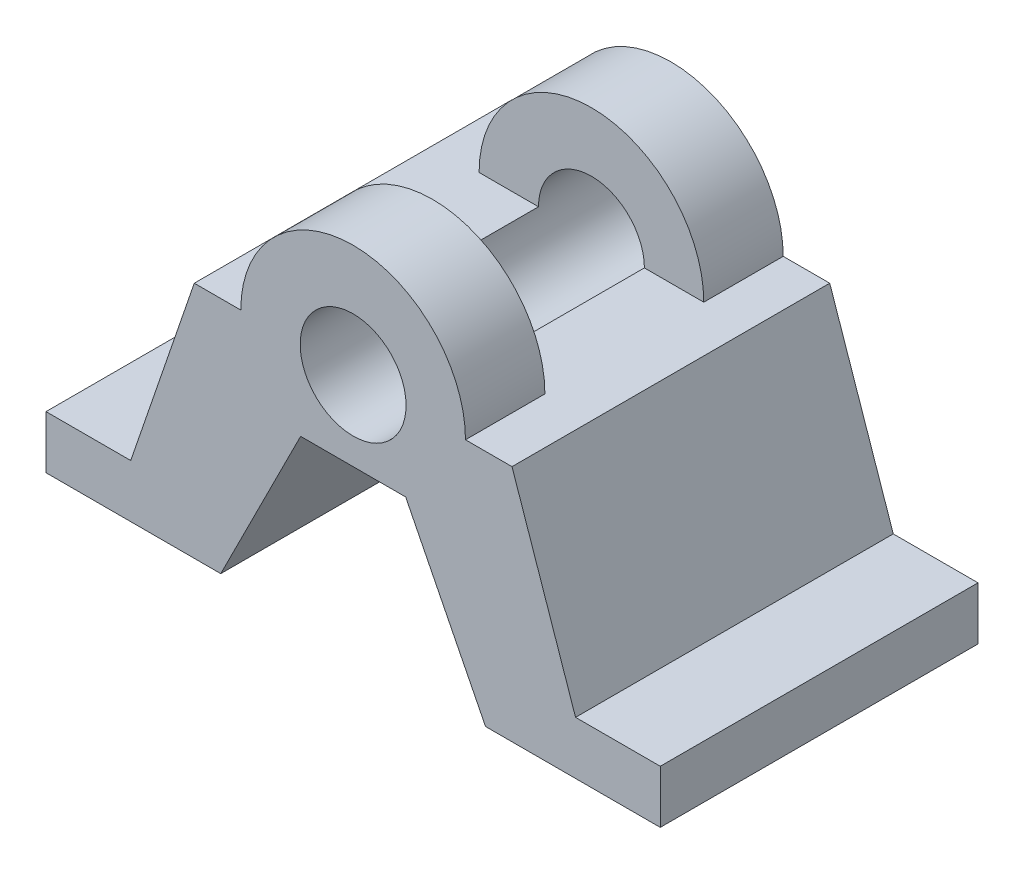
from build123d import *

# Parameters (mm, degrees)
BOSS_EXTRUDE1_DEPTH = 60
BOSS_EXTRUDE2_DEPTH = 15
SKETCH5_R           = 10
CUT_EXTRUDE1_DEPTH  = 107.5286833


with BuildPart() as part:
    # Sketch1 → Boss-Extrude1 (new body)
    with BuildSketch(Plane.XY):
        Polygon((-58, 0), (-58, 10), (-42, 10), (-30, 45), (30, 45), (42, 10), (58, 10), (58, 0), (25, 0), (9.917302162, 30), (-9.917302162, 30), (-25, 0), align=None)
    extrude(amount=-BOSS_EXTRUDE1_DEPTH)

    # Sketch2 → Boss-Extrude2 (add)
    with BuildSketch(Plane.XY):
        with BuildLine():
            Line((-18.06294145, 33.874117101), (18.06294145, 33.874117101))
            ThreePointArc((18.06294145, 33.874117101), (0, 66.214502683), (-18.06294145, 33.874117101))
        make_face()
    boss_extrude2 = extrude(amount=-BOSS_EXTRUDE2_DEPTH)

    # Sketch5 → Cut-Extrude1 (cut, through all)
    with BuildSketch(Plane.XY):
        with Locations((0, 45)):
            Circle(SKETCH5_R)
    cut_extrude1 = extrude(amount=-CUT_EXTRUDE1_DEPTH, mode=Mode.SUBTRACT)

    # Mirror1: Boss-Extrude2, Cut-Extrude1 across plane
    add(boss_extrude2.mirror(Plane.XY.offset(-30)))
    add(cut_extrude1.mirror(Plane.XY.offset(-30)), mode=Mode.SUBTRACT)


solid = part.part
